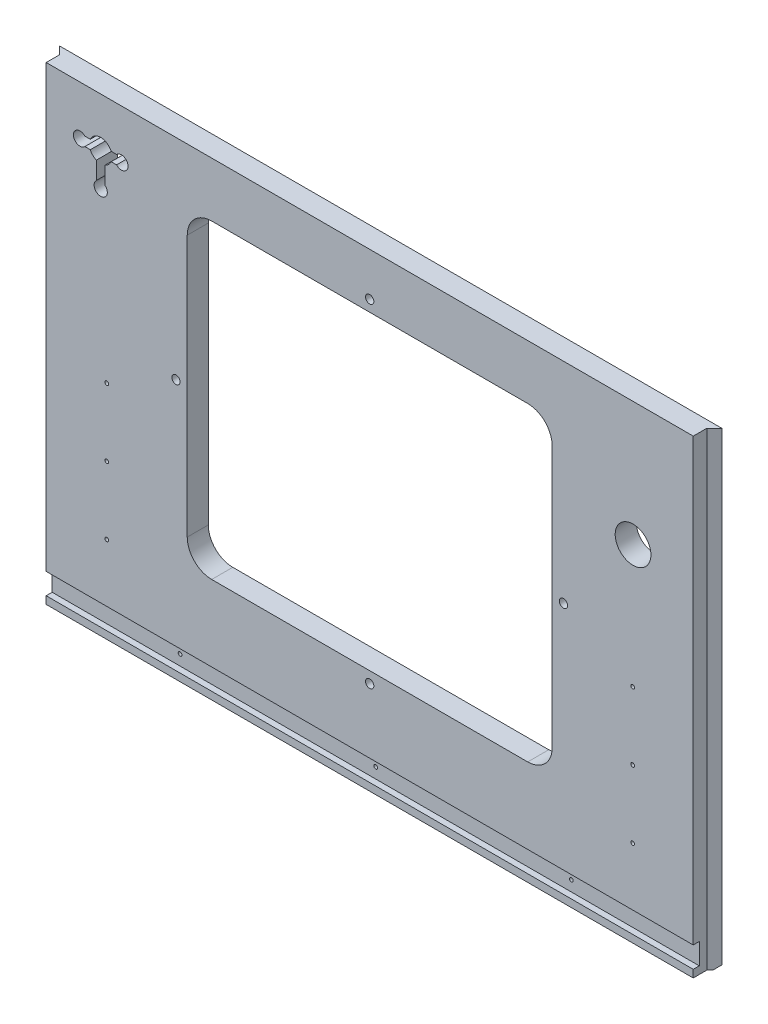
from build123d import *

# Parameters (mm, degrees)
EXTRUDE1_DEPTH     = 17.78
SKETCH3_R          = 15.08125
SKETCH3_R_2        = 3.4925
SKETCH3_R_3        = 1.5875
CUT_EXTRUDE1_DEPTH = 17.78
CUT_EXTRUDE2_DEPTH = 5.08
SKETCH5_W          = 14.2875
SKETCH5_H          = 404.0251
CUT_EXTRUDE3_DEPTH = 11.43
CUT_EXTRUDE4_DEPTH = 396.08125


with BuildPart() as part:
    # Sketch2 → Extrude1 (new body)
    with BuildSketch(Plane.XY):
        Polygon((11695.641666666, -6048.53375), (11699.451666666, -6052.34375), (12250.631666666, -6052.34375), (12254.441666666, -6048.53375), (12254.441666666, -5656.2625), (11695.641666666, -5656.2625), align=None)
    extrude(amount=-EXTRUDE1_DEPTH)

    # Sketch3 → Cut-Extrude1 (cut)
    with BuildSketch(Plane.XY):
        with Locations((12197.291666666, -5761.0375)):
            Circle(SKETCH3_R)
        with Locations((12138.554166666, -5833.26875)):
            Circle(SKETCH3_R_2)
        with Locations((12196.974166666, -5865.01875)):
            Circle(SKETCH3_R_3)
        with Locations((12196.974166666, -5922.16875)):
            Circle(SKETCH3_R_3)
        with Locations((12196.974166666, -5979.31875)):
            Circle(SKETCH3_R_3)
        with Locations((12140.141666666, -6037.10375)):
            Circle(SKETCH3_R_3)
        with Locations((11975.041666666, -6037.10375)):
            Circle(SKETCH3_R_3)
        with Locations((11809.941666666, -6037.10375)):
            Circle(SKETCH3_R_3)
        with Locations((11753.109166666, -5979.31875)):
            Circle(SKETCH3_R_3)
        with Locations((11753.109166666, -5922.16875)):
            Circle(SKETCH3_R_3)
        with Locations((11753.109166666, -5865.01875)):
            Circle(SKETCH3_R_3)
        with Locations((11811.529166666, -5833.26875)):
            Circle(SKETCH3_R_2)
        with Locations((11975.041666666, -5973.7625)):
            Circle(SKETCH3_R_2)
        with Locations((11975.041666666, -5692.775)):
            Circle(SKETCH3_R_2)
        with BuildLine():
            Line((11841.691666666, -5702.2873), (12108.391666666, -5702.2873))
            ThreePointArc((12108.391666666, -5702.2873), (12122.993563119, -5708.335603547), (12129.041866666, -5722.9375))
            Line((12129.041866666, -5722.9375), (12129.041866666, -5943.6))
            ThreePointArc((12129.041866666, -5943.6), (12122.993563119, -5958.201896453), (12108.391666666, -5964.2502))
            Line((12108.391666666, -5964.2502), (11841.691666666, -5964.2502))
            ThreePointArc((11841.691666666, -5964.2502), (11827.089770213, -5958.201896453), (11821.041466666, -5943.6))
            Line((11821.041466666, -5943.6), (11821.041466666, -5722.9375))
            ThreePointArc((11821.041466666, -5722.9375), (11827.089770213, -5708.335603547), (11841.691666666, -5702.2873))
        make_face()
        with BuildLine():
            Line((11734.654409808, -5693.754968556), (11739.23011943, -5693.754968556))
            ThreePointArc((11739.23011943, -5693.754968556), (11748.029166666, -5687.976468556), (11756.828213901, -5693.754968556))
            Line((11756.828213901, -5693.754968556), (11761.386355753, -5693.754968556))
            ThreePointArc((11761.386355753, -5693.754968556), (11767.531113043, -5692.357368906), (11771.079666666, -5697.564968556))
            ThreePointArc((11771.079666666, -5697.564968556), (11767.531113043, -5702.772568206), (11761.386355753, -5701.374968556))
            Line((11761.386355753, -5701.374968556), (11756.828213901, -5701.374968556))
            ThreePointArc((11756.828213901, -5701.374968556), (11754.760305425, -5704.393665595), (11751.712166666, -5706.417925308))
            Line((11751.712166666, -5706.417925308), (11751.712166666, -5721.30243896))
            ThreePointArc((11751.712166666, -5721.30243896), (11748.029166666, -5731.092968556), (11744.346166666, -5721.30243896))
            Line((11744.346166666, -5721.30243896), (11744.346166666, -5706.417925308))
            ThreePointArc((11744.346166666, -5706.417925308), (11741.298027907, -5704.393665595), (11739.23011943, -5701.374968556))
            Line((11739.23011943, -5701.374968556), (11734.654409809, -5701.374968556))
            ThreePointArc((11734.654409809, -5701.374968556), (11724.978666666, -5697.564968556), (11734.654409808, -5693.754968556))
        make_face()
    extrude(amount=-CUT_EXTRUDE1_DEPTH, mode=Mode.SUBTRACT)

    # Sketch4 → Cut-Extrude2 (cut)
    with BuildSketch(Plane.XY):
        Polygon((11975.041666666, -6028.21375), (11695.641666666, -6028.21375), (11695.641666666, -6045.99375), (12254.441666666, -6045.99375), (12254.441666666, -6028.21375), align=None)
    extrude(amount=-CUT_EXTRUDE2_DEPTH, mode=Mode.SUBTRACT)

    # Sketch5 → Cut-Extrude3 (cut)
    with BuildSketch(Plane.XY):
        with Locations((11694.847916666, -5853.51255)):
            Rectangle(SKETCH5_W, SKETCH5_H)
        with Locations((12255.235416666, -5853.51255)):
            Rectangle(SKETCH5_W, SKETCH5_H)
    extrude(amount=-CUT_EXTRUDE3_DEPTH, mode=Mode.SUBTRACT)

    # Sketch7 → Cut-Extrude4 (cut)
    with BuildSketch(Plane.XZ.offset(6052.34375)):
        Polygon((12254.441666666, -17.78), (12254.441666666, -11.43), (12248.091666666, -11.43), align=None)
        Polygon((11695.641666666, -17.78), (11695.641666666, -11.43), (11701.991666666, -11.43), align=None)
    extrude(amount=-CUT_EXTRUDE4_DEPTH, mode=Mode.SUBTRACT)


solid = part.part
